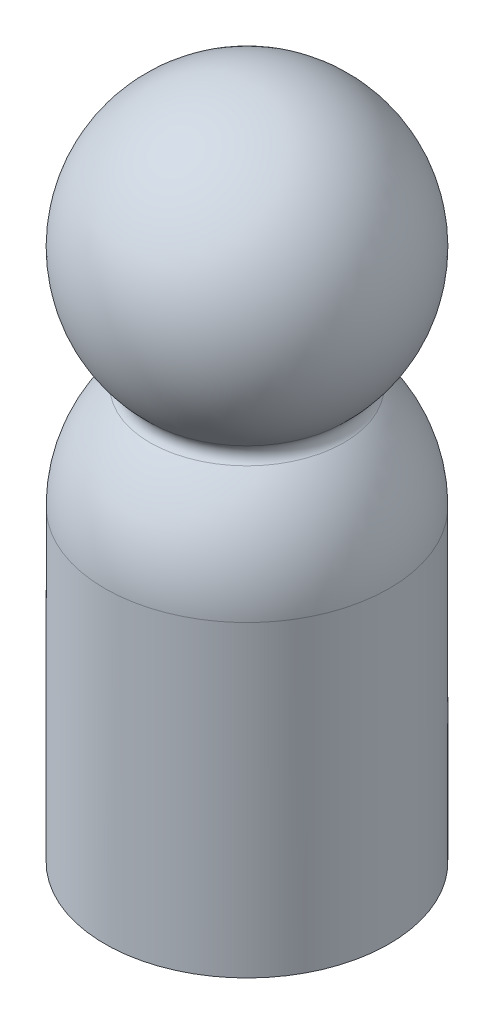
from build123d import *

# Parameters (mm, degrees)
SKETCH1_R           = 12
BOSS_EXTRUDE1_DEPTH = 26
FILLET1_R           = 1


with BuildPart() as part:
    # Sketch1 → Boss-Extrude1 (new body)
    with BuildSketch(Plane(origin=(0, 0, 0), x_dir=(1, 0, 0), z_dir=(0, 1, 0))):
        with Locations(Location((0, 0, 0), (0, 0, 90))):
            Circle(SKETCH1_R)
    extrude(amount=BOSS_EXTRUDE1_DEPTH)

    # Sketch2 → Revolve1 (revolve)
    with BuildSketch(Plane.XY, mode=Mode.PRIVATE) as revolve1_sk:
        with BuildLine():
            Line((0, 55.943780463), (0, 26))
            Line((0, 26), (12, 26))
            ThreePointArc((12, 26), (10.76980199, 31.292576415), (7.331439149, 35.5))
            ThreePointArc((7.331439149, 35.5), (11.357816692, 48.872983346), (0, 57))
            Line((0, 57), (0, 55.943780463))
        make_face()
    revolve(revolve1_sk.sketch.rotate(Axis((0, 55.943780463, 0), (0, -1, 0)), 270), axis=Axis((0, 55.943780463, 0), (0, -1, 0)))

    # Fillet1
    fillet1_edges = [part.edges().sort_by_distance(p)[0] for p in [
        (0, 35.5, 7.331439149),
    ]]
    fillet(fillet1_edges, radius=FILLET1_R)


solid = part.part
